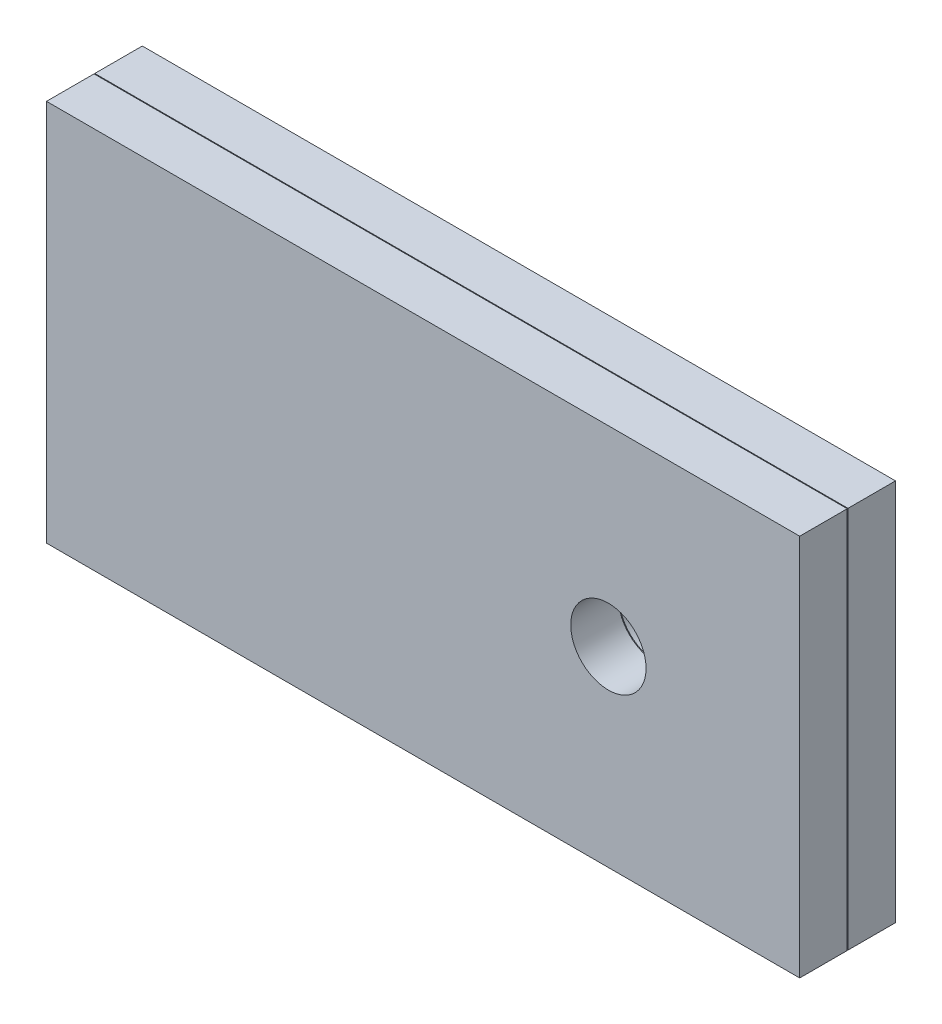
from build123d import *

# Parameters (mm, degrees)
CROQUIS1_W              = 100
CROQUIS1_H              = 50.8
SALIENTE_EXTRUIR1_DEPTH = 6.31
CROQUIS2_W              = 6.31
CROQUIS2_H              = 50.8
SALIENTE_EXTRUIR2_DEPTH = 100
CROQUIS3_R              = 5
CORTAR_EXTRUIR1_DEPTH   = 50


with BuildPart() as part:
    # Croquis1 → Saliente-Extruir1 (new body)
    with BuildSketch(Plane.XY):
        Rectangle(CROQUIS1_W, CROQUIS1_H)
    extrude(amount=SALIENTE_EXTRUIR1_DEPTH)


with BuildPart() as body_2:
    # Croquis2 → Saliente-Extruir2 (new body)
    with BuildSketch(Plane(origin=(50, 0, 0), x_dir=(0, 0, -1), z_dir=(1, 0, 0))):
        with Locations((3.255, 0)):
            Rectangle(CROQUIS2_W, CROQUIS2_H)
    extrude(amount=-SALIENTE_EXTRUIR2_DEPTH)


with BuildPart() as cortar_extruir1_tool:
    # Croquis3 → Cortar-Extruir1 (new body)
    with BuildSketch(Plane(origin=(0, 0, -6.41), x_dir=(-1, 0, 0), z_dir=(0, 0, -1))):
        with Locations(Location((-24.6, 0, 0), (0, 0, 90))):
            Circle(CROQUIS3_R)
    extrude(amount=-CORTAR_EXTRUIR1_DEPTH)


with BuildPart() as part_1:
    add(part.part)

    # Cortar-Extruir1: cut by cortar_extruir1_tool
    add(cortar_extruir1_tool.part, mode=Mode.SUBTRACT)


with BuildPart() as body_2_1:
    add(body_2.part)

    # Cortar-Extruir1: cut by cortar_extruir1_tool
    add(cortar_extruir1_tool.part, mode=Mode.SUBTRACT)


solid = Compound([part_1.part, body_2_1.part])
